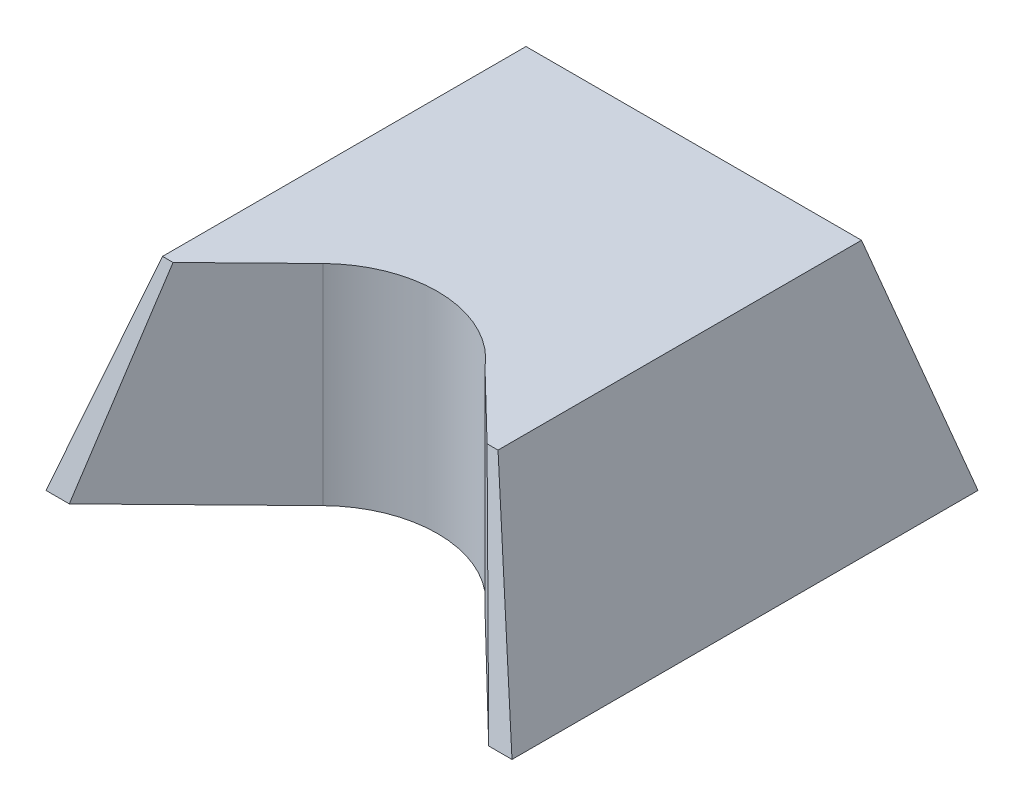
from build123d import *

# Parameters (mm, degrees)
GRUNDK_RPER_DEPTH               = 100
SCHRAEGEN_VORNE_DEPTH           = 100
SCHNITT_LINEAR_AUSTRAGEN4_DEPTH = 45
WANDUNG1_T                      = -1.75
AUFSATZ_LINEAR_AUSTRAGEN1_DEPTH = 40
AUFSATZ_LINEAR_AUSTRAGEN3_DEPTH = 3
SCHNITT_LINEAR_AUSTRAGEN6_DEPTH = 2.4
SKIZZE13_R                      = 1.7
SCHNITT_LINEAR_AUSTRAGEN7_DEPTH = 2.4


with BuildPart() as part:
    # Skizze1 → Grundkörper (new body)
    with BuildSketch(Plane.XY):
        Polygon((0, 0), (100, 0), (86, 45), (14, 45), align=None)
    extrude(amount=-GRUNDK_RPER_DEPTH)

    # Skizze2 → Schraegen_vorne (cut)
    with BuildSketch(Plane(origin=(0, 0, 0), x_dir=(0, 0, -1), z_dir=(1, 0, 0))):
        Polygon((100, 0), (89, 45), (100, 45), align=None)
    schraegen_vorne = extrude(amount=SCHRAEGEN_VORNE_DEPTH, mode=Mode.SUBTRACT)

    # Spiegel_Schraege_hinten: Schraegen_vorne across plane
    add(schraegen_vorne.mirror(Plane.XY.offset(-50)), mode=Mode.SUBTRACT)

    # Skizze4 → Schnitt-Linear austragen4 (cut)
    with BuildSketch(Plane.XZ):
        with BuildLine():
            Line((5, 0), (95, 0))
            Line((95, 0), (69.229297103, -24.976048727))
            ThreePointArc((69.229297103, -24.976048727), (51.299881289, -33.966183301), (32.533786025, -26.886625433))
            Line((32.533786025, -26.886625433), (5, 0))
        make_face()
    extrude(amount=-SCHNITT_LINEAR_AUSTRAGEN4_DEPTH, mode=Mode.SUBTRACT)

    # Wandung1
    wandung1_openings = [part.faces().sort_by_distance(p)[0] for p in [
        (50.008556747, 0, -58.352640724),
    ]]
    offset(amount=WANDUNG1_T, openings=wandung1_openings, kind=Kind.INTERSECTION)

    # Skizze5 → Aufsatz-Linear austragen1 (add)
    with BuildSketch(Plane.ZY.offset(-27)):
        Polygon((-90.998474583, 9), (-95.998474583, 9), (-96.609585694, 6.5), (-90.998474583, 6.5), align=None)
    extrude(amount=-AUFSATZ_LINEAR_AUSTRAGEN1_DEPTH)

    # Skizze10 → Aufsatz-Linear austragen3 (add)
    with BuildSketch(Plane(origin=(0, 12.75, 0), x_dir=(-1, 0, 0), z_dir=(0, -1, 0))):
        with BuildLine():
            Line((-45, 35.278555896), (-45, 38.999999059))
            ThreePointArc((-45, 38.999999059), (-49.999999529, 44), (-55, 39))
            Line((-55, 39), (-55, 35.278555896))
            ThreePointArc((-55, 35.278555896), (-50, 35.75), (-45, 35.278555896))
        make_face()
    extrude(amount=-AUFSATZ_LINEAR_AUSTRAGEN3_DEPTH)

    # Skizze12 → Schnitt-Linear austragen6 (cut)
    with BuildSketch(Plane.XZ.offset(-12.75)):
        Polygon((46.651368439, -39), (48.325684219, -41.9), (51.674315781, -41.9), (53.348631561, -39), (51.674315781, -36.1), (48.325684219, -36.1), align=None)
    extrude(amount=-SCHNITT_LINEAR_AUSTRAGEN6_DEPTH, mode=Mode.SUBTRACT)

    # Skizze13 → Schnitt-Linear austragen7 (cut)
    with BuildSketch(Plane(origin=(0, 15.75, 0), x_dir=(1, 0, 0), z_dir=(0, 1, 0))):
        with Locations(Location((50, 39, 0), (0, 0, 270))):
            Circle(SKIZZE13_R)
    extrude(amount=-SCHNITT_LINEAR_AUSTRAGEN7_DEPTH, mode=Mode.SUBTRACT)


solid = part.part
